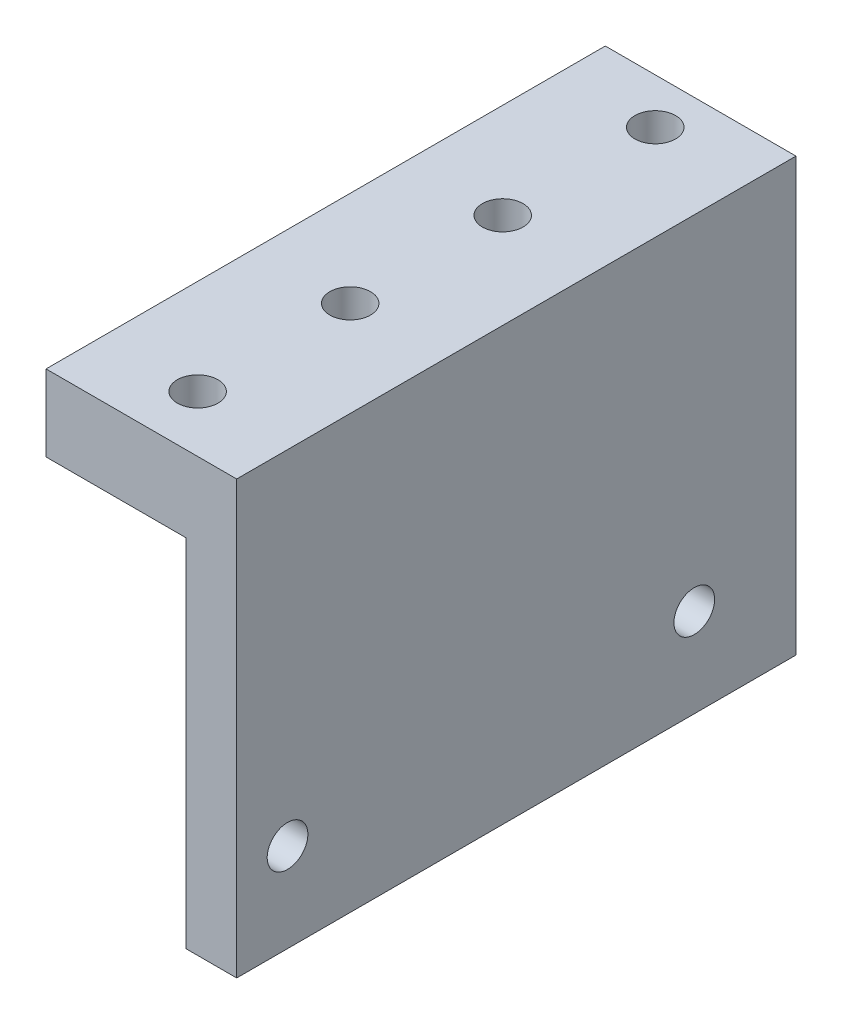
from build123d import *

# Parameters (mm, degrees)
BOSS_EXTRUDE1_DEPTH = 44
SKETCH3_R           = 1.6
CUT_EXTRUDE2_DEPTH  = 10
SKETCH2_R           = 1.6
CUT_EXTRUDE3_DEPTH  = 10


with BuildPart() as part:
    # Sketch1 → Boss-Extrude1 (new body)
    with BuildSketch(Plane.XY):
        Polygon((-80.585156419, 60.740798274), (-80.585156419, 54.740798274), (-69.585156419, 54.740798274), (-69.585156419, 26.740798274), (-65.585156419, 26.740798274), (-65.585156419, 60.740798274), align=None)
    extrude(amount=BOSS_EXTRUDE1_DEPTH)

    # Sketch3 → Cut-Extrude2 (cut)
    with BuildSketch(Plane(origin=(-65.585156419, 0, 0), x_dir=(0, 0, -1), z_dir=(1, 0, 0))):
        with Locations((-40, 33.740798274)):
            Circle(SKETCH3_R)
        with Locations((-8, 33.740798274)):
            Circle(SKETCH3_R)
    extrude(amount=-CUT_EXTRUDE2_DEPTH, mode=Mode.SUBTRACT)

    # Sketch2 → Cut-Extrude3 (cut)
    with BuildSketch(Plane(origin=(0, 60.740798274, 0), x_dir=(1, 0, 0), z_dir=(0, 1, 0))):
        with Locations(Location((-73.085156419, -3.571673595, 0), (0, 0, 180))):
            Circle(SKETCH2_R)
        with Locations(Location((-73.085156419, -15.571673595, 0), (0, 0, 180))):
            Circle(SKETCH2_R)
        with Locations(Location((-73.085156419, -27.571673595, 0), (0, 0, 180))):
            Circle(SKETCH2_R)
        with Locations(Location((-73.085156419, -39.571673595, 0), (0, 0, 180))):
            Circle(SKETCH2_R)
    extrude(amount=-CUT_EXTRUDE3_DEPTH, mode=Mode.SUBTRACT)


solid = part.part
